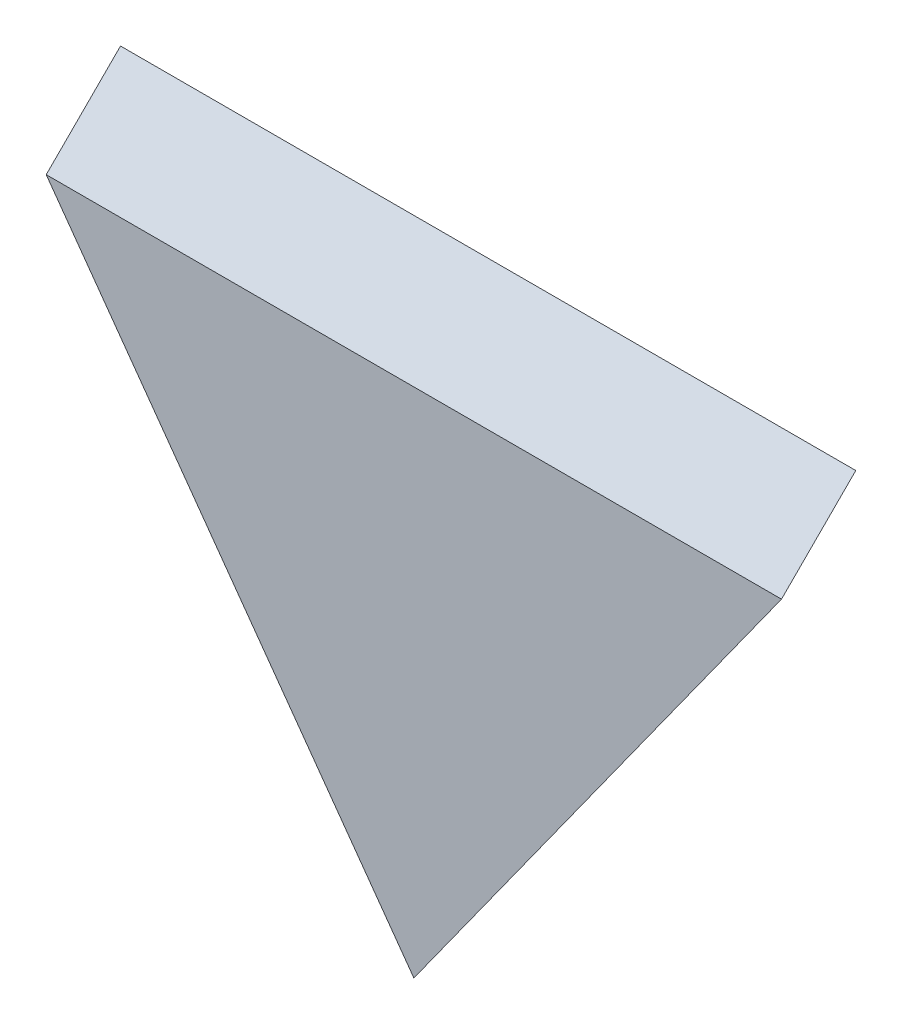
from build123d import *


with BuildPart() as part:
    # Sweep1: sweep along a path in Sketch2
    with BuildLine(Plane(origin=(0, 0, 0), x_dir=(0, 0, -1), z_dir=(1, 0, 0))) as sweep1_path:
        Line((0, 0), (8.980256121, 8.980256121))
    # Sketch1 → Sweep1 (sweep)
    with BuildSketch(Plane.XY):
        Polygon((0, 0), (44.45, 61.89214409), (-44.45, 61.89214409), align=None)
    sweep(path=sweep1_path.line)


solid = part.part
